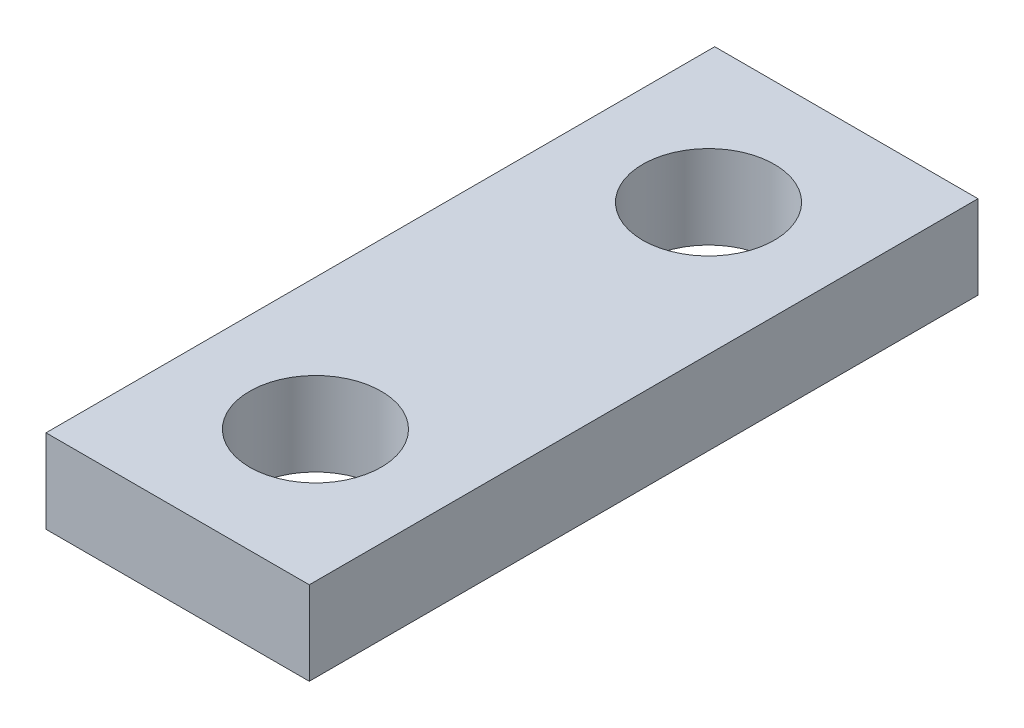
from build123d import *

# Parameters (mm, degrees)
SKETCH1_W           = 10
SKETCH1_H           = 25.4
BOSS_EXTRUDE1_DEPTH = 1.5875
SKETCH2_R           = 2.5
CUT_EXTRUDE1_DEPTH  = 15.013230356


with BuildPart() as part:
    # Sketch1 → Boss-Extrude1 (new, symmetric)
    with BuildSketch(Plane(origin=(0, 0, 0), x_dir=(1, 0, 0), z_dir=(0, 1, 0))):
        Rectangle(SKETCH1_W, SKETCH1_H)
    extrude(amount=BOSS_EXTRUDE1_DEPTH, both=True)

    # Sketch2 → Cut-Extrude1 (cut, through all)
    with BuildSketch(Plane(origin=(0, 1.5875, 0), x_dir=(1, 0, 0), z_dir=(0, 1, 0))):
        with Locations(Location((0, 7.465, 0), (0, 0, 270))):
            Circle(SKETCH2_R)
        with Locations(Location((0, -7.465, 0), (0, 0, 270))):
            Circle(SKETCH2_R)
    extrude(amount=-CUT_EXTRUDE1_DEPTH, mode=Mode.SUBTRACT)


solid = part.part
